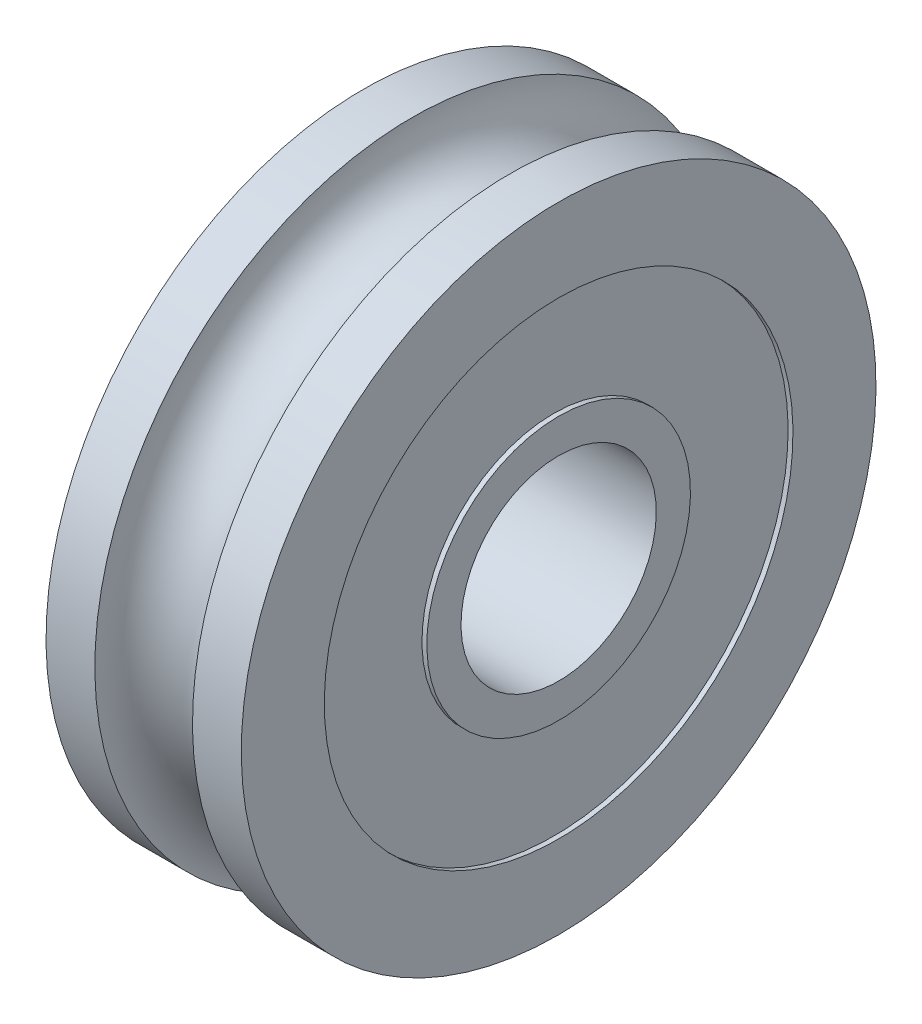
from build123d import *

# Parameters (mm, degrees)
SKETCH2_R          = 2
CUT_EXTRUDE1_DEPTH = 11.024968828
SKETCH3_R          = 4.8
SKETCH3_R_2        = 2.7
CUT_EXTRUDE2_DEPTH = 0.1


with BuildPart() as part:
    # Sketch1 → Revolve1 (revolve)
    with BuildSketch(Plane.XY, mode=Mode.PRIVATE) as revolve1_sk:
        with BuildLine():
            Line((1, 6.5), (2, 6.5))
            Line((2, 6.5), (2, 0))
            Line((2, 0), (-2, 0))
            Line((-2, 0), (-2, 6.5))
            Line((-2, 6.5), (-1, 6.5))
            ThreePointArc((-1, 6.5), (0, 5.5), (1, 6.5))
        make_face()
    revolve(revolve1_sk.sketch.rotate(Axis((2, 0, 0), (1, 0, 0)), 180), axis=Axis((2, 0, 0), (1, 0, 0)))

    # Sketch2 → Cut-Extrude1 (cut, through all)
    with BuildSketch(Plane(origin=(2, 0, 0), x_dir=(0, 0, -1), z_dir=(1, 0, 0))):
        with Locations(Location((0, 0, 0), (0, 0, 90))):
            Circle(SKETCH2_R)
    extrude(amount=-CUT_EXTRUDE1_DEPTH, mode=Mode.SUBTRACT)

    # Sketch3 → Cut-Extrude2 (cut)
    with BuildSketch(Plane(origin=(2, 0, 0), x_dir=(0, 0, -1), z_dir=(1, 0, 0))):
        with Locations(Location((0, 0, 0), (0, 0, 90))):
            Circle(SKETCH3_R)
        with Locations(Location((0, 0, 0), (0, 0, 90))):
            Circle(SKETCH3_R_2, mode=Mode.SUBTRACT)
    cut_extrude2 = extrude(amount=-CUT_EXTRUDE2_DEPTH, mode=Mode.SUBTRACT)

    # Mirror1: Cut-Extrude2 across plane
    add(cut_extrude2.mirror(Plane(origin=(0, 0, 0), x_dir=(0, 0, 1), z_dir=(1, 0, 0))), mode=Mode.SUBTRACT)


solid = part.part
